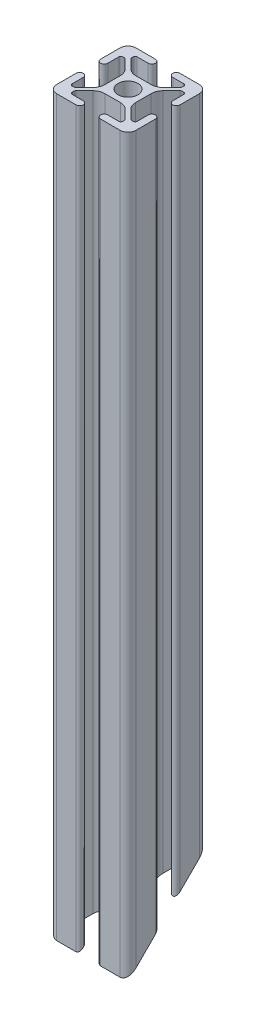
from build123d import *

# Parameters (mm, degrees)
SKETCH_1_R          = 2.5
EXTRUDE_1_DEPTH     = 185
CUT_EXTRUDE_2_DEPTH = 189.494453685


with BuildPart() as part:
    # 草图1 → 凸台-拉伸1 (new body)
    with BuildSketch(Plane(origin=(0, 0, 0), x_dir=(1, 0, 0), z_dir=(0, 1, 0))):
        with BuildLine():
            Line((-1.042752475, -10.085861632), (3.857247525, -10.085861632))
            ThreePointArc((3.857247525, -10.085861632), (4.757247525, -10.985861632), (3.857247525, -11.885861632))
            Line((3.857247525, -11.885861632), (1.076161722, -11.885861632))
            ThreePointArc((1.076161722, -11.885861632), (0.722608332, -12.032308241), (0.576161722, -12.385861632))
            Line((0.576161722, -12.385861632), (0.576161722, -12.790788968))
            ThreePointArc((0.576161722, -12.790788968), (0.614221956, -12.982130685), (0.722608332, -13.144342359))
            Line((0.722608332, -13.144342359), (2.885447948, -15.307181975))
            ThreePointArc((2.885447948, -15.307181975), (3.858717994, -15.957500229), (5.006768291, -16.185861632))
            Line((5.006768291, -16.185861632), (8.907726758, -16.185861632))
            ThreePointArc((8.907726758, -16.185861632), (10.055777055, -15.957500229), (11.029047102, -15.307181975))
            Line((11.029047102, -15.307181975), (13.191886718, -13.144342359))
            ThreePointArc((13.191886718, -13.144342359), (13.300273094, -12.982130685), (13.338333327, -12.790788968))
            Line((13.338333327, -12.790788968), (13.338333327, -12.385861632))
            ThreePointArc((13.338333327, -12.385861632), (13.191886718, -12.032308241), (12.838333327, -11.885861632))
            Line((12.838333327, -11.885861632), (10.057247525, -11.885861632))
            ThreePointArc((10.057247525, -11.885861632), (9.157247525, -10.985861632), (10.057247525, -10.085861632))
            Line((10.057247525, -10.085861632), (14.957247525, -10.085861632))
            ThreePointArc((14.957247525, -10.085861632), (16.371461087, -10.671648069), (16.957247525, -12.085861632))
            Line((16.957247525, -12.085861632), (16.957247525, -16.985861632))
            ThreePointArc((16.957247525, -16.985861632), (16.057247525, -17.885861632), (15.157247525, -16.985861632))
            Line((15.157247525, -16.985861632), (15.157247525, -14.204775829))
            ThreePointArc((15.157247525, -14.204775829), (15.010800915, -13.851222438), (14.657247525, -13.704775829))
            Line((14.657247525, -13.704775829), (14.252320188, -13.704775829))
            ThreePointArc((14.252320188, -13.704775829), (14.060978472, -13.742836063), (13.898766797, -13.851222438))
            Line((13.898766797, -13.851222438), (11.735927181, -16.014062054))
            ThreePointArc((11.735927181, -16.014062054), (11.085608927, -16.987332101), (10.857247525, -18.135382398))
            Line((10.857247525, -18.135382398), (10.857247525, -22.036340865))
            ThreePointArc((10.857247525, -22.036340865), (11.085608927, -23.184391162), (11.735927181, -24.157661209))
            Line((11.735927181, -24.157661209), (13.898766797, -26.320500825))
            ThreePointArc((13.898766797, -26.320500825), (14.060978472, -26.4288872), (14.252320188, -26.466947434))
            Line((14.252320188, -26.466947434), (14.657247525, -26.466947434))
            ThreePointArc((14.657247525, -26.466947434), (15.010800915, -26.320500825), (15.157247525, -25.966947434))
            Line((15.157247525, -25.966947434), (15.157247525, -23.185861632))
            ThreePointArc((15.157247525, -23.185861632), (16.057247525, -22.285861632), (16.957247525, -23.185861632))
            Line((16.957247525, -23.185861632), (16.957247525, -28.085861632))
            ThreePointArc((16.957247525, -28.085861632), (16.371461087, -29.500075194), (14.957247525, -30.085861632))
            Line((14.957247525, -30.085861632), (10.057247525, -30.085861632))
            ThreePointArc((10.057247525, -30.085861632), (9.157247525, -29.185861632), (10.057247525, -28.285861632))
            Line((10.057247525, -28.285861632), (12.838333327, -28.285861632))
            ThreePointArc((12.838333327, -28.285861632), (13.191886718, -28.139415022), (13.338333327, -27.785861632))
            Line((13.338333327, -27.785861632), (13.338333327, -27.380934295))
            ThreePointArc((13.338333327, -27.380934295), (13.300273094, -27.189592579), (13.191886718, -27.027380904))
            Line((13.191886718, -27.027380904), (11.029047102, -24.864541288))
            ThreePointArc((11.029047102, -24.864541288), (10.055777055, -24.214223034), (8.907726758, -23.985861632))
            Line((8.907726758, -23.985861632), (5.006768291, -23.985861632))
            ThreePointArc((5.006768291, -23.985861632), (3.858717994, -24.214223034), (2.885447948, -24.864541288))
            Line((2.885447948, -24.864541288), (0.722608332, -27.027380904))
            ThreePointArc((0.722608332, -27.027380904), (0.614221956, -27.189592579), (0.576161722, -27.380934295))
            Line((0.576161722, -27.380934295), (0.576161722, -27.785861632))
            ThreePointArc((0.576161722, -27.785861632), (0.722608332, -28.139415022), (1.076161722, -28.285861632))
            Line((1.076161722, -28.285861632), (3.857247525, -28.285861632))
            ThreePointArc((3.857247525, -28.285861632), (4.757247525, -29.185861632), (3.857247525, -30.085861632))
            Line((3.857247525, -30.085861632), (-1.042752475, -30.085861632))
            ThreePointArc((-1.042752475, -30.085861632), (-2.456966038, -29.500075194), (-3.042752475, -28.085861632))
            Line((-3.042752475, -28.085861632), (-3.042752475, -23.185861632))
            ThreePointArc((-3.042752475, -23.185861632), (-2.142752475, -22.285861632), (-1.242752475, -23.185861632))
            Line((-1.242752475, -23.185861632), (-1.242752475, -25.966947434))
            ThreePointArc((-1.242752475, -25.966947434), (-1.096305866, -26.320500825), (-0.742752475, -26.466947434))
            Line((-0.742752475, -26.466947434), (-0.337825138, -26.466947434))
            ThreePointArc((-0.337825138, -26.466947434), (-0.146483422, -26.4288872), (0.015728252, -26.320500825))
            Line((0.015728252, -26.320500825), (2.178567868, -24.157661209))
            ThreePointArc((2.178567868, -24.157661209), (2.828886122, -23.184391162), (3.057247525, -22.036340865))
            Line((3.057247525, -22.036340865), (3.057247525, -18.135382398))
            ThreePointArc((3.057247525, -18.135382398), (2.828886122, -16.987332101), (2.178567868, -16.014062054))
            Line((2.178567868, -16.014062054), (0.015728252, -13.851222438))
            ThreePointArc((0.015728252, -13.851222438), (-0.146483422, -13.742836063), (-0.337825138, -13.704775829))
            Line((-0.337825138, -13.704775829), (-0.742752475, -13.704775829))
            ThreePointArc((-0.742752475, -13.704775829), (-1.096305866, -13.851222438), (-1.242752475, -14.204775829))
            Line((-1.242752475, -14.204775829), (-1.242752475, -16.985861632))
            ThreePointArc((-1.242752475, -16.985861632), (-2.142752475, -17.885861632), (-3.042752475, -16.985861632))
            Line((-3.042752475, -16.985861632), (-3.042752475, -12.085861632))
            ThreePointArc((-3.042752475, -12.085861632), (-2.456966038, -10.671648069), (-1.042752475, -10.085861632))
        make_face()
        with Locations(Location((6.957247525, -20.085861632, 0), (0, 0, 270))):
            Circle(SKETCH_1_R, mode=Mode.SUBTRACT)
    extrude(amount=EXTRUDE_1_DEPTH)

    # 草图3 → 切除-拉伸2 (cut, through all)
    with BuildSketch(Plane(origin=(16.957247525, 0, 0), x_dir=(0, 0, -1), z_dir=(1, 0, 0))):
        Polygon((-30.085861632, 0), (-10.085861632, 0), (-10.085861632, 20), align=None)
    extrude(amount=-CUT_EXTRUDE_2_DEPTH, mode=Mode.SUBTRACT)


solid = part.part
